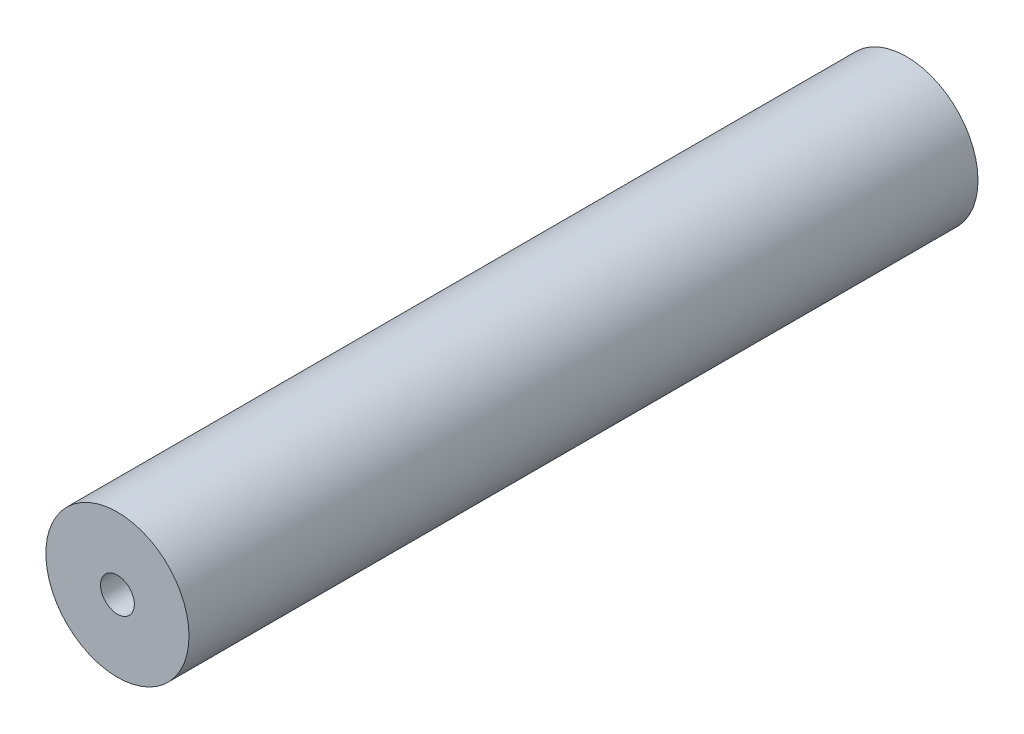
from build123d import *

# Parameters (mm, degrees)
CROQUIS1_R              = 6.35
SALIENTE_EXTRUIR1_DEPTH = 70
CROQUIS2_R              = 1.5
CORTAR_EXTRUIR1_DEPTH   = 20
CORTAR_EXTRUIR2_START   = -20
CROQUIS3_R              = 1.5
CORTAR_EXTRUIR2_DEPTH   = 20


with BuildPart() as part:
    # Croquis1 → Saliente-Extruir1 (new body)
    with BuildSketch(Plane.XY):
        Circle(CROQUIS1_R)
    extrude(amount=SALIENTE_EXTRUIR1_DEPTH)

    # Croquis2 → Cortar-Extruir1 (cut)
    with BuildSketch(Plane.XY.offset(70)):
        Circle(CROQUIS2_R)
    extrude(amount=-CORTAR_EXTRUIR1_DEPTH, mode=Mode.SUBTRACT)

    # Croquis3 → Cortar-Extruir2 (cut)
    with BuildSketch(Plane(origin=(0, 0, 0), x_dir=(-1, 0, 0), z_dir=(0, 0, -1)).offset(CORTAR_EXTRUIR2_START)):
        with Locations(Location((0, 0, 0), (0, 0, 180))):
            Circle(CROQUIS3_R)
    extrude(amount=CORTAR_EXTRUIR2_DEPTH, mode=Mode.SUBTRACT)


solid = part.part
